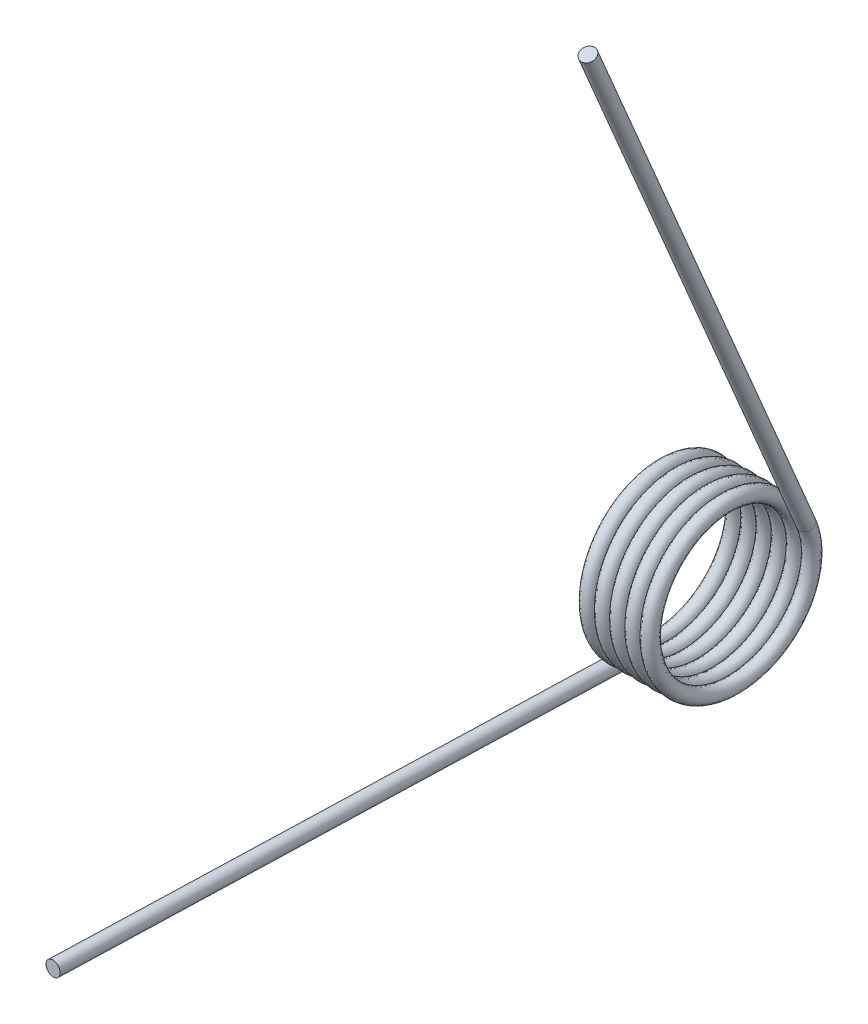
from build123d import *

# Parameters (mm, degrees)
SWEEP1_PITCH       = 0.6604
SWEEP1_HEIGHT      = 3.510961696
SWEEP1_RADIUS      = 3.344167008
SWEEP1_START_ANGLE = 90
SKETCH2_R          = 0.3175
SKETCH3_R          = 0.3175
EXTRUDE1_DEPTH     = 25.4
SKETCH4_R          = 0.3175
EXTRUDE2_DEPTH     = 25.4


with BuildPart() as part:
    # Sweep1: sweep along a helix
    with BuildLine() as sweep1_path:
        add(Helix(SWEEP1_PITCH, SWEEP1_HEIGHT, SWEEP1_RADIUS, center=(0, 0, 0), direction=(1, 0, 0), mode=Mode.PRIVATE).rotate(Axis((0, 0, 0), (1, 0, 0)), SWEEP1_START_ANGLE))
    # Sketch2 → Sweep1 (sweep)
    with BuildSketch(Plane(origin=(0, -3.344167008, 0), x_dir=(-0.9995064548684439, 2.6721530143218954e-14, -0.031414115876710585), z_dir=(0.031414115876710585, 9.9587471789471e-15, -0.9995064548684439))):
        Circle(SKETCH2_R)
    sweep(path=sweep1_path.line, is_frenet=True)

    # Sketch3 → Extrude1 (add)
    with BuildSketch(Plane(origin=(0, 0, 0), x_dir=(0.9995064548684439, -2.6693777230677115e-14, 0.031414115876710585), z_dir=(-0.031414115876710585, -9.958747178947102e-15, 0.9995064548684439))):
        with Locations((0, -3.344167008)):
            Circle(SKETCH3_R)
    extrude(amount=EXTRUDE1_DEPTH)

    # Sketch4 → Extrude2 (add)
    with BuildSketch(Plane(origin=(0.003464781, 0.100778885, 0.044680248), x_dir=(0.4943889276570288, 0.338043987844521, -0.8008157406621742), z_dir=(0.03141411587671053, 0.9137315432513993, 0.40510223424599984))):
        with Locations(Location((4.64220255, -1.395742018, 0), (0, 0, 119.645556243))):
            Circle(SKETCH4_R)
    extrude(amount=EXTRUDE2_DEPTH)


solid = part.part
